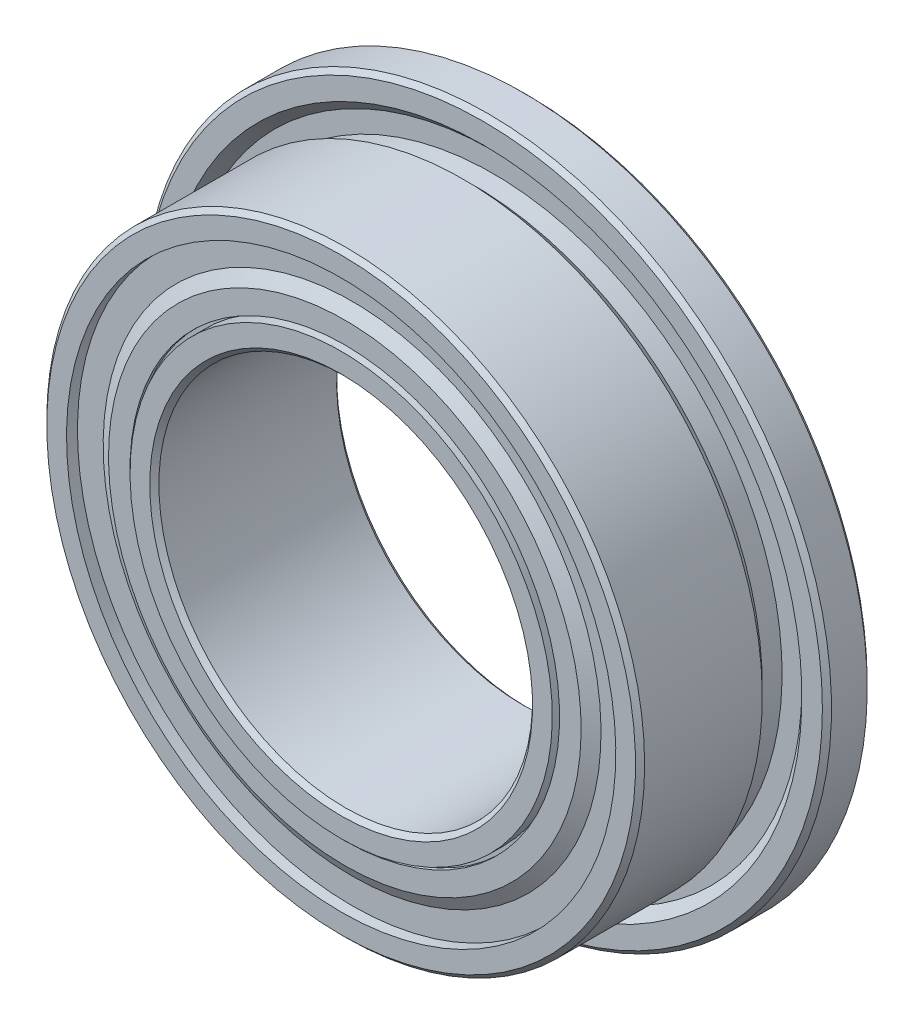
from build123d import *

# Parameters (mm, degrees)
FILLET1_SIZE      = 0.0609375
FILLET2_SIZE      = 0.0609375
CIRPATTERN3_COUNT = 21
SKETCH8_W         = 0.195
SKETCH8_H         = 0.1625


with BuildPart() as part:
    # Sketch2 → Revolve1 (revolve)
    with BuildSketch(Plane(origin=(0, 0, 0), x_dir=(0, 0, -1), z_dir=(1, 0, 0)), mode=Mode.PRIVATE) as revolve1_sk:
        with BuildLine():
            Line((1.25, 4.6), (0.65, 4.6))
            Line((0.65, 4.6), (0.65, 4.265165043))
            Line((0.65, 4.265165043), (0.782582521, 4.132582521))
            Line((0.782582521, 4.132582521), (0.782582521, 3.867417479))
            Line((0.782582521, 3.867417479), (0.517417479, 3.867417479))
            Line((0.517417479, 3.867417479), (0.384834957, 4))
            Line((0.384834957, 4), (-1.25, 4))
            Line((-1.25, 4), (-1.25, 3.5125))
            Line((-1.25, 3.5125), (-0.301817412, 3.5125))
            ThreePointArc((-0.301817412, 3.5125), (0, 3.65), (0.301817412, 3.5125))
            Line((0.301817412, 3.5125), (1.25, 3.5125))
            Line((1.25, 3.5125), (1.25, 4.6))
        make_face()
        with BuildLine():
            Line((1.25, 2.5), (-1.25, 2.5))
            Line((-1.25, 2.5), (-1.25, 2.9875))
            Line((-1.25, 2.9875), (-0.301817412, 2.9875))
            ThreePointArc((-0.301817412, 2.9875), (0, 2.85), (0.301817412, 2.9875))
            Line((0.301817412, 2.9875), (1.25, 2.9875))
            Line((1.25, 2.9875), (1.25, 2.5))
        make_face()
    revolve(revolve1_sk.sketch.rotate(Axis((0, 0, 0), (0, 0, -1)), 180), axis=Axis((0, 0, 0), (0, 0, -1)))

    # Fillet1
    fillet1_edges = [part.edges().sort_by_distance(p)[0] for p in [
        (0, 4, 1.25),
        (0, 4.6, -1.25),
        (0, 4.6, -0.65),
    ]]
    chamfer(fillet1_edges, length=FILLET1_SIZE)

    # Fillet2
    fillet2_edges = [part.edges().sort_by_distance(p)[0] for p in [
        (0, 2.5, -1.25),
        (0, 2.5, 1.25),
    ]]
    chamfer(fillet2_edges, length=FILLET2_SIZE)

    # Sketch8 → Cut-Revolve1 (revolve, cut)
    with BuildSketch(Plane(origin=(0, 0, 0), x_dir=(0, 0, -1), z_dir=(1, 0, 0)), mode=Mode.PRIVATE) as cut_revolve1_sk:
        with Locations((-1.1525, 3.59375)):
            Rectangle(SKETCH8_W, SKETCH8_H)
        with Locations((1.1525, 3.59375)):
            Rectangle(SKETCH8_W, SKETCH8_H)
        with Locations((1.1525, 2.90625)):
            Rectangle(SKETCH8_W, SKETCH8_H)
        with Locations((-1.1525, 2.90625)):
            Rectangle(SKETCH8_W, SKETCH8_H)
    revolve(cut_revolve1_sk.sketch.rotate(Axis((0, 0, 0), (0, 0, -1)), 180), axis=Axis((0, 0, 0), (0, 0, -1)), mode=Mode.SUBTRACT)


with BuildPart() as body_2:
    # Sketch7 → Revolve3 (revolve)
    with BuildSketch(Plane.XY):
        with BuildLine():
            Line((0, 3.65), (0, 2.85))
            ThreePointArc((0, 2.85), (-0.4, 3.25), (0, 3.65))
        make_face()
    revolve(axis=Axis((0, 3.65, 0), (0, -1, 0)))


with BuildPart() as cirpattern3_1:
    # CirPattern3: pattern copy
    add(body_2.part.rotate(Axis((0, 0, 0), (0, 0, 1)), 1 * 360 / CIRPATTERN3_COUNT))


with BuildPart() as cirpattern3_2:
    # CirPattern3: pattern copy
    add(body_2.part.rotate(Axis((0, 0, 0), (0, 0, 1)), 2 * 360 / CIRPATTERN3_COUNT))


with BuildPart() as cirpattern3_3:
    # CirPattern3: pattern copy
    add(body_2.part.rotate(Axis((0, 0, 0), (0, 0, 1)), 3 * 360 / CIRPATTERN3_COUNT))


with BuildPart() as cirpattern3_4:
    # CirPattern3: pattern copy
    add(body_2.part.rotate(Axis((0, 0, 0), (0, 0, 1)), 4 * 360 / CIRPATTERN3_COUNT))


with BuildPart() as cirpattern3_5:
    # CirPattern3: pattern copy
    add(body_2.part.rotate(Axis((0, 0, 0), (0, 0, 1)), 5 * 360 / CIRPATTERN3_COUNT))


with BuildPart() as cirpattern3_6:
    # CirPattern3: pattern copy
    add(body_2.part.rotate(Axis((0, 0, 0), (0, 0, 1)), 6 * 360 / CIRPATTERN3_COUNT))


with BuildPart() as cirpattern3_7:
    # CirPattern3: pattern copy
    add(body_2.part.rotate(Axis((0, 0, 0), (0, 0, 1)), 7 * 360 / CIRPATTERN3_COUNT))


with BuildPart() as cirpattern3_8:
    # CirPattern3: pattern copy
    add(body_2.part.rotate(Axis((0, 0, 0), (0, 0, 1)), 8 * 360 / CIRPATTERN3_COUNT))


with BuildPart() as cirpattern3_9:
    # CirPattern3: pattern copy
    add(body_2.part.rotate(Axis((0, 0, 0), (0, 0, 1)), 9 * 360 / CIRPATTERN3_COUNT))


with BuildPart() as cirpattern3_10:
    # CirPattern3: pattern copy
    add(body_2.part.rotate(Axis((0, 0, 0), (0, 0, 1)), 10 * 360 / CIRPATTERN3_COUNT))


with BuildPart() as cirpattern3_11:
    # CirPattern3: pattern copy
    add(body_2.part.rotate(Axis((0, 0, 0), (0, 0, 1)), 11 * 360 / CIRPATTERN3_COUNT))


with BuildPart() as cirpattern3_12:
    # CirPattern3: pattern copy
    add(body_2.part.rotate(Axis((0, 0, 0), (0, 0, 1)), 12 * 360 / CIRPATTERN3_COUNT))


with BuildPart() as cirpattern3_13:
    # CirPattern3: pattern copy
    add(body_2.part.rotate(Axis((0, 0, 0), (0, 0, 1)), 13 * 360 / CIRPATTERN3_COUNT))


with BuildPart() as cirpattern3_14:
    # CirPattern3: pattern copy
    add(body_2.part.rotate(Axis((0, 0, 0), (0, 0, 1)), 14 * 360 / CIRPATTERN3_COUNT))


with BuildPart() as cirpattern3_15:
    # CirPattern3: pattern copy
    add(body_2.part.rotate(Axis((0, 0, 0), (0, 0, 1)), 15 * 360 / CIRPATTERN3_COUNT))


with BuildPart() as cirpattern3_16:
    # CirPattern3: pattern copy
    add(body_2.part.rotate(Axis((0, 0, 0), (0, 0, 1)), 16 * 360 / CIRPATTERN3_COUNT))


with BuildPart() as cirpattern3_17:
    # CirPattern3: pattern copy
    add(body_2.part.rotate(Axis((0, 0, 0), (0, 0, 1)), 17 * 360 / CIRPATTERN3_COUNT))


with BuildPart() as cirpattern3_18:
    # CirPattern3: pattern copy
    add(body_2.part.rotate(Axis((0, 0, 0), (0, 0, 1)), 18 * 360 / CIRPATTERN3_COUNT))


with BuildPart() as cirpattern3_19:
    # CirPattern3: pattern copy
    add(body_2.part.rotate(Axis((0, 0, 0), (0, 0, 1)), 19 * 360 / CIRPATTERN3_COUNT))


with BuildPart() as cirpattern3_20:
    # CirPattern3: pattern copy
    add(body_2.part.rotate(Axis((0, 0, 0), (0, 0, 1)), 20 * 360 / CIRPATTERN3_COUNT))


with BuildPart() as body_23:
    # Sketch9 → Revolve4 (revolve)
    with BuildSketch(Plane(origin=(0, 0, 0), x_dir=(0, 0, -1), z_dir=(1, 0, 0)), mode=Mode.PRIVATE) as revolve4_sk:
        Polygon((-1.055, 3.675), (-1.055, 3.317857143), (-1.1525, 3.148982189), (-1.1525, 2.87375), (-1.20125, 2.87375), (-1.20125, 3.162044712), (-1.10375, 3.330919666), (-1.10375, 3.675), align=None)
        Polygon((1.055, 3.675), (1.055, 3.317857143), (1.1525, 3.148982189), (1.1525, 2.87375), (1.20125, 2.87375), (1.20125, 3.162044712), (1.10375, 3.330919666), (1.10375, 3.675), align=None)
    revolve(revolve4_sk.sketch.rotate(Axis((0, 0, 0), (0, 0, -1)), 180), axis=Axis((0, 0, 0), (0, 0, -1)))


solid = Compound([part.part, body_2.part, cirpattern3_1.part, cirpattern3_2.part, cirpattern3_3.part, cirpattern3_4.part, cirpattern3_5.part, cirpattern3_6.part, cirpattern3_7.part, cirpattern3_8.part, cirpattern3_9.part, cirpattern3_10.part, cirpattern3_11.part, cirpattern3_12.part, cirpattern3_13.part, cirpattern3_14.part, cirpattern3_15.part, cirpattern3_16.part, cirpattern3_17.part, cirpattern3_18.part, cirpattern3_19.part, cirpattern3_20.part, body_23.part])
